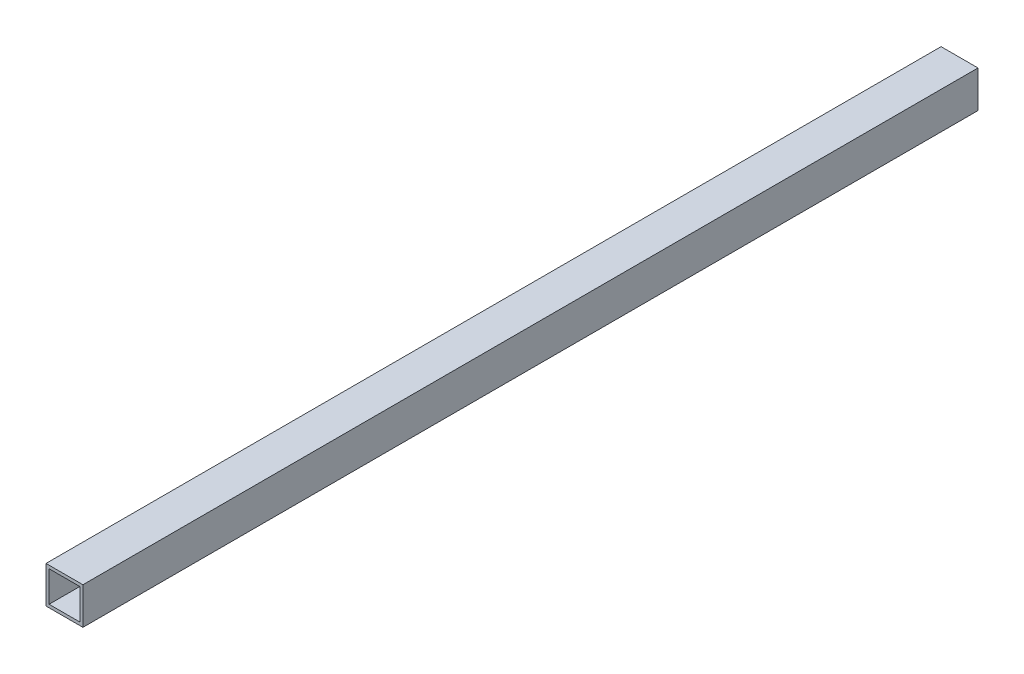
from build123d import *

# Parameters (mm, degrees)
SKETCH1_W           = 19.05
SKETCH1_H           = 19.05
SKETCH1_W_2         = 15.875
SKETCH1_H_2         = 15.875
BOSS_EXTRUDE1_DEPTH = 461.9


with BuildPart() as part:
    # Sketch1 → Boss-Extrude1 (new body)
    with BuildSketch(Plane(origin=(0, 0, 830.697963948), x_dir=(-1, 0, 0), z_dir=(0, 0, -1))):
        with Locations((272.905449824, -3.994098241)):
            Rectangle(SKETCH1_W, SKETCH1_H)
        with Locations((272.905449824, -3.994098241)):
            Rectangle(SKETCH1_W_2, SKETCH1_H_2, mode=Mode.SUBTRACT)
    extrude(amount=BOSS_EXTRUDE1_DEPTH)


solid = part.part
